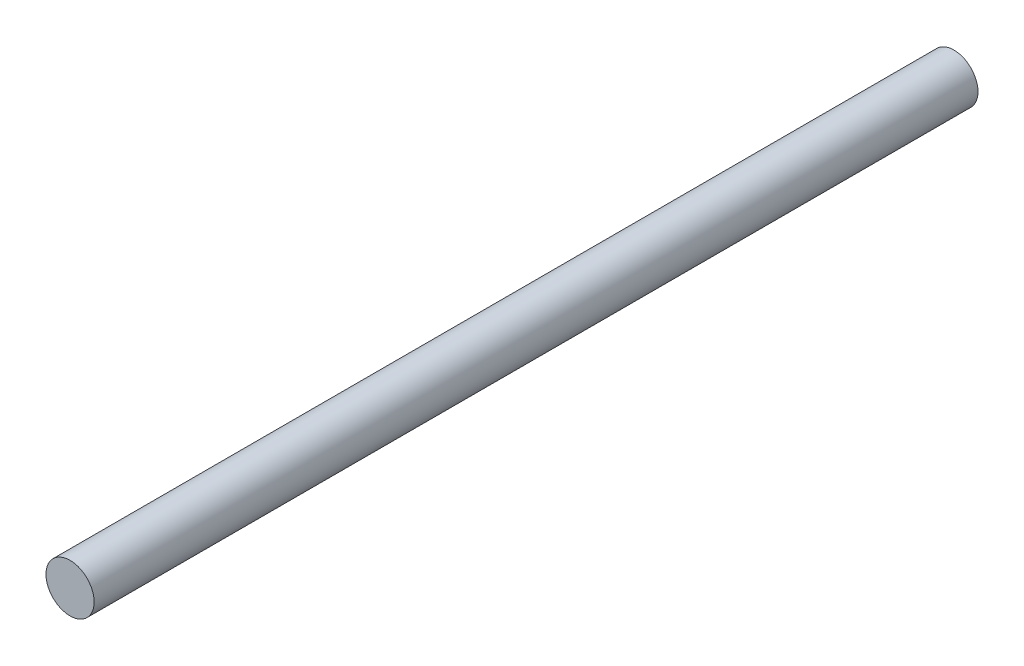
from build123d import *

# Parameters (mm, degrees)
SKETCH1_R           = 1.3843
BOSS_EXTRUDE1_DEPTH = 50.8


with BuildPart() as part:
    # Sketch1 → Boss-Extrude1 (new body)
    with BuildSketch(Plane.XY):
        Circle(SKETCH1_R)
    extrude(amount=BOSS_EXTRUDE1_DEPTH)


solid = part.part
